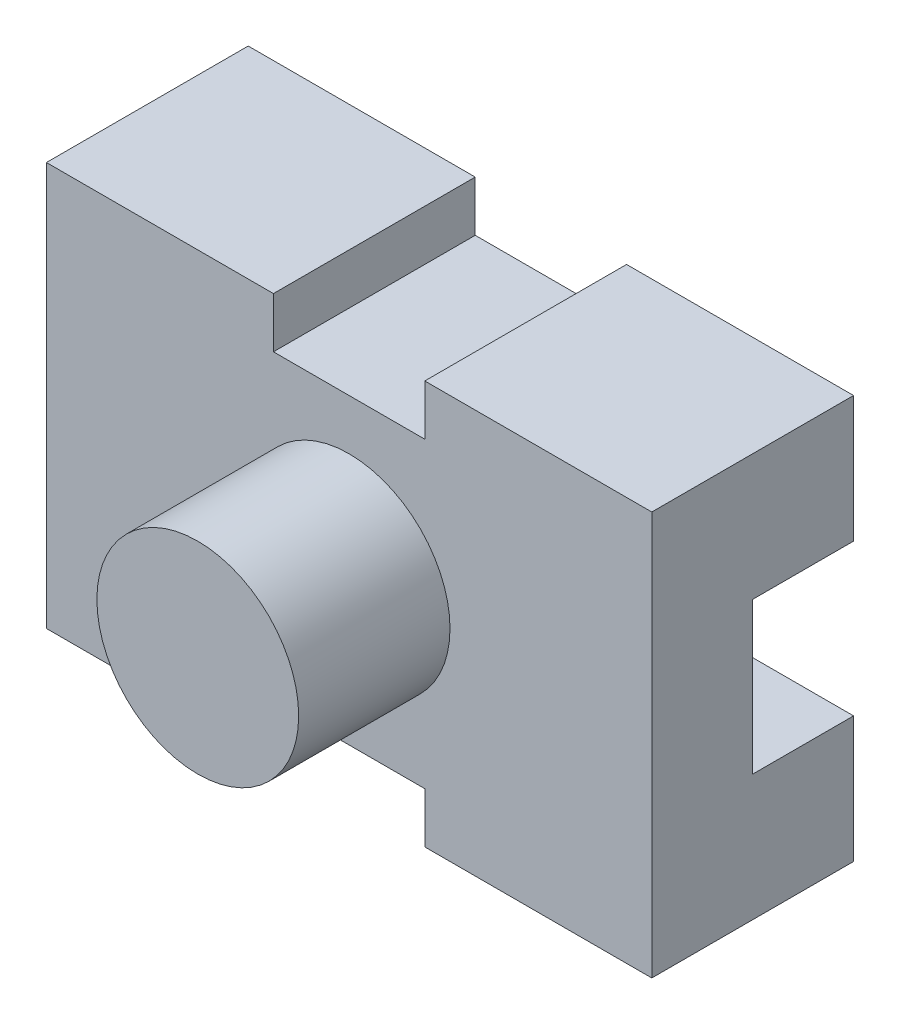
from build123d import *

# Parameters (mm, degrees)
SKETCH_1_W          = 60
SKETCH_1_H          = 40
EXTRUDE_1_DEPTH     = 20
SKETCH_2_R          = 10
EXTRUDE_2_DEPTH     = 15
SKETCH_3_W          = 15
SKETCH_3_H          = 5
CUT_EXTRUDE_1_DEPTH = 42.231056256
SKETCH_4_W          = 10
SKETCH_4_H          = 15
CUT_EXTRUDE_2_DEPTH = 73.284161474


with BuildPart() as part:
    # Эскиз1 → Бобышка-Вытянуть1 (new body)
    with BuildSketch(Plane.XY):
        Rectangle(SKETCH_1_W, SKETCH_1_H)
    extrude(amount=EXTRUDE_1_DEPTH)

    # Эскиз2 → Бобышка-Вытянуть2 (add)
    with BuildSketch(Plane.XY.offset(20)):
        with Locations(Location((0, 0, 0), (0, 0, 180))):
            Circle(SKETCH_2_R)
    extrude(amount=EXTRUDE_2_DEPTH)

    # Эскиз3 → Вырез-Вытянуть1 (cut, through all)
    with BuildSketch(Plane.XY.offset(20)):
        with Locations((0, -17.5)):
            Rectangle(SKETCH_3_W, SKETCH_3_H)
    cut_extrude_1 = extrude(amount=-CUT_EXTRUDE_1_DEPTH, mode=Mode.SUBTRACT)

    # Зеркальное отражение1: Вырез-Вытянуть1 across plane
    add(cut_extrude_1.mirror(Plane.ZX), mode=Mode.SUBTRACT)

    # Эскиз4 → Вырез-Вытянуть2 (cut, through all)
    with BuildSketch(Plane.ZY.offset(30)):
        with Locations((5, 0)):
            Rectangle(SKETCH_4_W, SKETCH_4_H)
    extrude(amount=-CUT_EXTRUDE_2_DEPTH, mode=Mode.SUBTRACT)


solid = part.part
